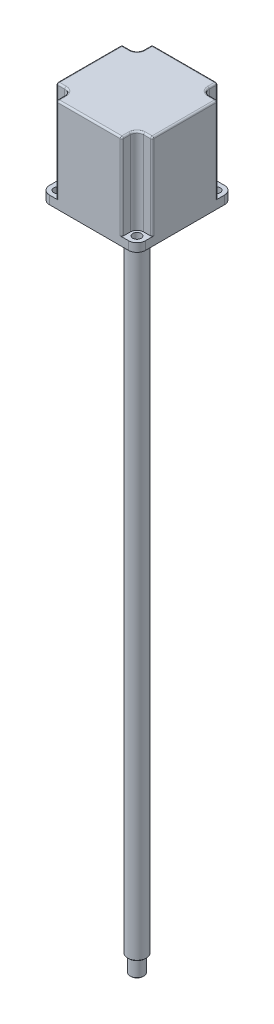
from build123d import *

# Parameters (mm, degrees)
SKETCH1_W                = 57
SKETCH1_H                = 57
EXTRUDE1_DEPTH           = 76
F_5_0_5_DIAMETER_HOLE1_D = 5
SKETCH6_R                = 4
SKETCH6_R_2              = 2.5
EXTRUDE4_DEPTH           = 71
FILLET1_R                = 5
SKETCH7_R                = 3
EXTRUDE5_DEPTH           = 101
SKETCH8_R                = 19.05
EXTRUDE6_DEPTH           = 3
FILLET2_R                = 1
SKETCH9_R                = 5.5
BOSS_EXTRUDE1_DEPTH      = 388
CHAMFER1_SIZE            = 0.5
SKETCH10_R               = 4
BOSS_EXTRUDE2_DEPTH      = 10
CHAMFER2_SIZE            = 0.5
CUT_EXTRUDE1_REACH       = 405.07
SKETCH11_W               = 81.226597498
SKETCH11_H               = 31.824543895
FILLET3_R                = 1


with BuildPart() as part:
    # Sketch1 → Extrude1 (new body)
    with BuildSketch(Plane(origin=(0, 0, 0), x_dir=(1, 0, 0), z_dir=(0, 1, 0))):
        Rectangle(SKETCH1_W, SKETCH1_H)
    extrude(amount=EXTRUDE1_DEPTH)

    # Ø5.0 (5) Diameter Hole1 (through all)
    with Locations(Plane.XZ):
        with Locations((-23.5, 23.5), (23.5, 23.5), (23.5, -23.5), (-23.5, -23.5)):
            Hole(F_5_0_5_DIAMETER_HOLE1_D / 2)

    # Sketch6 → Extrude4 (cut)
    # profile 1 of 12: a face of its own
    with BuildSketch(Plane(origin=(0, 76, 0), x_dir=(1, 0, 0), z_dir=(0, 1, 0))):
        Polygon((-28.5, 28.5), (-19.5, 28.5), (-19.5, 32.511741208), (-33.908905561, 32.511741208), (-33.908905561, 19.5), (-28.5, 19.5), align=None)
    # profile 2 of 12: a face of its own
    with BuildSketch(Plane(origin=(0, 76, 0), x_dir=(1, 0, 0), z_dir=(0, 1, 0))):
        with BuildLine():
            ThreePointArc((-23.5, 19.5), (-26.328427125, 26.328427125), (-19.5, 23.5))
            Line((-19.5, 23.5), (-19.5, 28.5))
            Line((-19.5, 28.5), (-28.5, 28.5))
            Line((-28.5, 28.5), (-28.5, 19.5))
            Line((-28.5, 19.5), (-23.5, 19.5))
        make_face()
    # profile 3 of 12: a face of its own
    with BuildSketch(Plane(origin=(0, 76, 0), x_dir=(1, 0, 0), z_dir=(0, 1, 0))):
        with Locations((-23.5, 23.5)):
            Circle(SKETCH6_R)
        with Locations(Location((-23.5, 23.5, 0), (0, 0, 90))):
            Circle(SKETCH6_R_2, mode=Mode.SUBTRACT)
    # profile 4 of 12: a face of its own
    with BuildSketch(Plane(origin=(0, 76, 0), x_dir=(1, 0, 0), z_dir=(0, 1, 0))):
        Polygon((19.5, 36.471560472), (19.5, 28.5), (28.5, 28.5), (28.5, 19.5), (41.168352552, 19.5), (41.168352552, 36.471560472), align=None)
    # profile 5 of 12: a face of its own
    with BuildSketch(Plane(origin=(0, 76, 0), x_dir=(1, 0, 0), z_dir=(0, 1, 0))):
        with BuildLine():
            Line((28.5, 28.5), (19.5, 28.5))
            Line((19.5, 28.5), (19.5, 23.5))
            ThreePointArc((19.5, 23.5), (23.5, 27.5), (27.5, 23.5))
            ThreePointArc((27.5, 23.5), (26.328427125, 20.671572875), (23.5, 19.5))
            Line((23.5, 19.5), (28.5, 19.5))
            Line((28.5, 19.5), (28.5, 28.5))
        make_face()
    # profile 6 of 12: a face of its own
    with BuildSketch(Plane(origin=(0, 76, 0), x_dir=(1, 0, 0), z_dir=(0, 1, 0))):
        with Locations((23.5, 23.5)):
            Circle(SKETCH6_R)
        with Locations(Location((23.5, 23.5, 0), (0, 0, 90))):
            Circle(SKETCH6_R_2, mode=Mode.SUBTRACT)
    # profile 7 of 12: a face of its own
    with BuildSketch(Plane(origin=(0, 76, 0), x_dir=(1, 0, 0), z_dir=(0, 1, 0))):
        with Locations((23.5, -23.5)):
            Circle(SKETCH6_R)
        with Locations(Location((23.5, -23.5, 0), (0, 0, 90))):
            Circle(SKETCH6_R_2, mode=Mode.SUBTRACT)
    # profile 8 of 12: a face of its own
    with BuildSketch(Plane(origin=(0, 76, 0), x_dir=(1, 0, 0), z_dir=(0, 1, 0))):
        with BuildLine():
            Line((28.5, -28.5), (28.5, -19.5))
            Line((28.5, -19.5), (23.5, -19.5))
            ThreePointArc((23.5, -19.5), (26.328427125, -20.671572875), (27.5, -23.5))
            ThreePointArc((27.5, -23.5), (23.5, -27.5), (19.5, -23.5))
            Line((19.5, -23.5), (19.5, -28.5))
            Line((19.5, -28.5), (28.5, -28.5))
        make_face()
    # profile 9 of 12: a face of its own
    with BuildSketch(Plane(origin=(0, 76, 0), x_dir=(1, 0, 0), z_dir=(0, 1, 0))):
        Polygon((44.252209519, -19.5), (28.5, -19.5), (28.5, -28.5), (19.5, -28.5), (19.5, -40.050429997), (44.252209519, -40.050429997), align=None)
    # profile 10 of 12: a face of its own
    with BuildSketch(Plane(origin=(0, 76, 0), x_dir=(1, 0, 0), z_dir=(0, 1, 0))):
        Polygon((-28.5, -28.5), (-28.5, -19.5), (-37.670786859, -19.5), (-37.670786859, -37.828231874), (-19.5, -37.828231874), (-19.5, -28.5), align=None)
    # profile 11 of 12: a face of its own
    with BuildSketch(Plane(origin=(0, 76, 0), x_dir=(1, 0, 0), z_dir=(0, 1, 0))):
        with BuildLine():
            Line((-23.5, -19.5), (-28.5, -19.5))
            Line((-28.5, -19.5), (-28.5, -28.5))
            Line((-28.5, -28.5), (-19.5, -28.5))
            Line((-19.5, -28.5), (-19.5, -23.5))
            ThreePointArc((-19.5, -23.5), (-26.328427125, -26.328427125), (-23.5, -19.5))
        make_face()
    # profile 12 of 12: a face of its own
    with BuildSketch(Plane(origin=(0, 76, 0), x_dir=(1, 0, 0), z_dir=(0, 1, 0))):
        with Locations((-23.5, -23.5)):
            Circle(SKETCH6_R)
        with Locations(Location((-23.5, -23.5, 0), (0, 0, 90))):
            Circle(SKETCH6_R_2, mode=Mode.SUBTRACT)
    extrude(amount=-EXTRUDE4_DEPTH, mode=Mode.SUBTRACT)

    # Fillet1
    fillet1_edges = [part.edges().sort_by_distance(p)[0] for p in [
        (-28.5, 2.5, 28.5),
        (-28.5, 2.5, -28.5),
        (28.5, 2.5, -28.5),
        (28.5, 2.5, 28.5),
    ]]
    fillet(fillet1_edges, radius=FILLET1_R)



with BuildPart() as body_2:
    # Sketch7 → Extrude5 (new body)
    with BuildSketch(Plane(origin=(0, 76, 0), x_dir=(1, 0, 0), z_dir=(0, 1, 0))):
        with Locations(Location((0, 0, 0), (0, 0, 270))):
            Circle(SKETCH7_R)
    extrude(amount=-EXTRUDE5_DEPTH)


with BuildPart() as part_1:
    add(part.part)

    add(body_2.part)  # Extrude6 merges body 2
    # Sketch8 → Extrude6 (add)
    with BuildSketch(Plane.XZ):
        with Locations(Location((0, 0, 0), (0, 0, 270))):
            Circle(SKETCH8_R)
    extrude(amount=EXTRUDE6_DEPTH)

    # Fillet2
    fillet2_edges = [part_1.edges().sort_by_distance(p)[0] for p in [
        (-28.5, 40.5, 19.5),
        (0, 76, 28.5),
        (-19.5, 40.5, 28.5),
        (-19.5, 76, 26),
        (-20.671572875, 76, 20.671572875),
        (-26, 76, 19.5),
        (-28.5, 76, 0),
        (-28.5, 40.5, -19.5),
        (-19.5, 40.5, -28.5),
        (-19.5, 76, -26),
        (-26, 76, -19.5),
        (-20.671572875, 76, -20.671572875),
        (0, 76, -28.5),
        (19.5, 76, -26),
        (26, 76, -19.5),
        (20.671572875, 76, -20.671572875),
        (19.5, 40.5, -28.5),
        (28.5, 40.5, -19.5),
        (19.5, 40.5, 28.5),
        (28.5, 76, 0),
        (26, 76, 19.5),
        (19.5, 76, 26),
        (20.671572875, 76, 20.671572875),
        (28.5, 40.5, 19.5),
    ]]
    fillet(fillet2_edges, radius=FILLET2_R)

    # Sketch9 → Boss-Extrude1 (add)
    with BuildSketch(Plane.XZ):
        with Locations(Location((0, 0, 0), (0, 0, 90))):
            Circle(SKETCH9_R)
    extrude(amount=BOSS_EXTRUDE1_DEPTH)

    # Chamfer1
    chamfer1_edges = [part_1.edges().sort_by_distance(p)[0] for p in [
        (0, -388, -5.5),
    ]]
    chamfer(chamfer1_edges, length=CHAMFER1_SIZE)

    # Sketch10 → Boss-Extrude2 (add)
    with BuildSketch(Plane.XZ.offset(388)):
        with Locations(Location((0, 0, 0), (0, 0, 270))):
            Circle(SKETCH10_R)
    extrude(amount=BOSS_EXTRUDE2_DEPTH)

    # Chamfer2
    chamfer2_edges = [part_1.edges().sort_by_distance(p)[0] for p in [
        (0, -398, 4),
    ]]
    chamfer(chamfer2_edges, length=CHAMFER2_SIZE)

    # Sketch11 → Cut-Extrude1 (cut, up to next)
    with BuildSketch(Plane.XY.offset(28.5), mode=Mode.PRIVATE) as cut_extrude1_sk1:
        with Locations((1.076178023, 71.912271948)):
            Rectangle(SKETCH11_W, SKETCH11_H)
    cut_extrude1_tool1 = extrude(cut_extrude1_sk1.sketch, amount=-CUT_EXTRUDE1_REACH, mode=Mode.PRIVATE) & part_1.part
    add(cut_extrude1_tool1.solids().sort_by_distance((1.076178, 71.912272, 28.5))[0], mode=Mode.SUBTRACT)

    # Fillet3
    fillet3_edges = [part_1.edges().sort_by_distance(p)[0] for p in [
        (0, 56, 28.5),
        (19.5, 56, 25.5),
        (19.207106781, 56, 28.207106781),
        (-19.207106781, 56, 28.207106781),
        (-28.207106781, 56, 19.207106781),
        (-28.207106781, 56, -19.207106781),
        (-19.207106781, 56, -28.207106781),
        (19.207106781, 56, -28.207106781),
        (19.5, 56, -25.5),
        (25.5, 56, -19.5),
        (28.207106781, 56, -19.207106781),
        (28.207106781, 56, 19.207106781),
        (25.5, 56, 19.5),
        (28.5, 56, 0),
        (0, 56, -28.5),
        (-28.5, 56, 0),
        (-25.5, 56, -19.5),
        (-19.5, 56, -25.5),
        (-20.671572875, 56, -20.671572875),
        (20.671572875, 56, -20.671572875),
        (20.671572875, 56, 20.671572875),
        (-19.5, 56, 25.5),
        (-25.5, 56, 19.5),
        (-20.671572875, 56, 20.671572875),
    ]]
    fillet(fillet3_edges, radius=FILLET3_R)


solid = part_1.part
